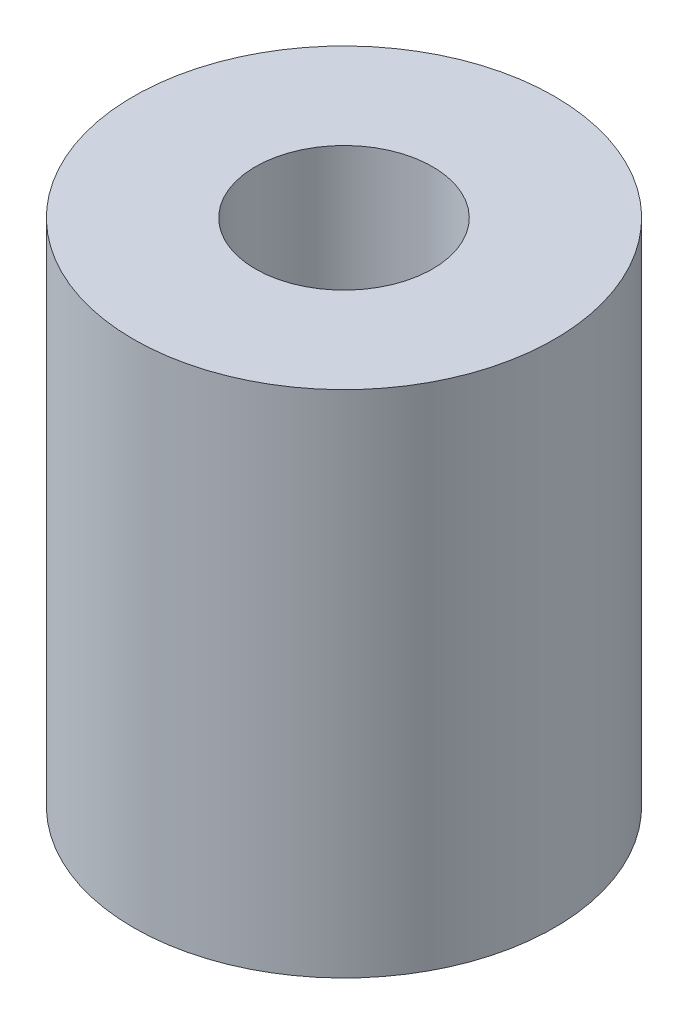
from build123d import *

# Parameters (mm, degrees)
SKETCH1_R           = 9.5
SKETCH1_R_2         = 2.5
BOSS_EXTRUDE1_DEPTH = 23
SKETCH2_R           = 4
CUT_EXTRUDE1_DEPTH  = 12


with BuildPart() as part:
    # Sketch1 → Boss-Extrude1 (new body)
    with BuildSketch(Plane(origin=(0, 0, 0), x_dir=(1, 0, 0), z_dir=(0, 1, 0))):
        with Locations(Location((0, 0, 0), (0, 0, 270))):
            Circle(SKETCH1_R)
        with Locations(Location((0, 0, 0), (0, 0, 270))):
            Circle(SKETCH1_R_2, mode=Mode.SUBTRACT)
    extrude(amount=BOSS_EXTRUDE1_DEPTH)

    # Sketch2 → Cut-Extrude1 (cut)
    with BuildSketch(Plane(origin=(0, 23, 0), x_dir=(1, 0, 0), z_dir=(0, 1, 0))):
        with Locations(Location((0, 0, 0), (0, 0, 270))):
            Circle(SKETCH2_R)
    extrude(amount=-CUT_EXTRUDE1_DEPTH, mode=Mode.SUBTRACT)


solid = part.part
